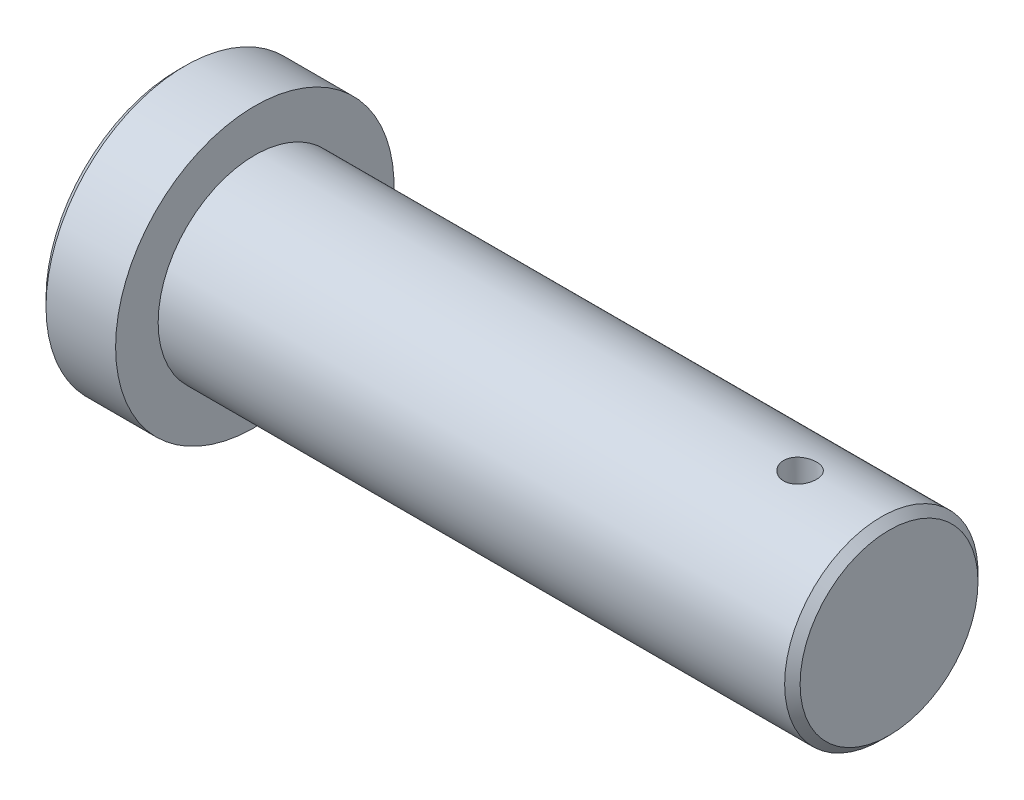
from build123d import *

# Parameters (mm, degrees)
CHAMFER1_SIZE = 1


with BuildPart() as part:
    # Sketch1 → Revolve1 (revolve)
    with BuildSketch(Plane.XY, mode=Mode.PRIVATE) as revolve1_sk:
        Polygon((0, 0), (0, 18), (10, 18), (10, 12.5), (92, 12.5), (92, 0), align=None)
    revolve(revolve1_sk.sketch.rotate(Axis((0, 0, 0), (1, 0, 0)), 90), axis=Axis((0, 0, 0), (1, 0, 0)))

    # Sketch2 → Cut-Revolve1 (revolve, cut)
    with BuildSketch(Plane.XY, mode=Mode.PRIVATE) as cut_revolve1_sk:
        Polygon((83, -12.5), (82.625, 12.5), (80.5, 12.5), (80.5, -12.5), align=None)
    revolve(cut_revolve1_sk.sketch.rotate(Axis((80.5, 12.5, 0), (0, -1, 0)), 227.113167314), axis=Axis((80.5, 12.5, 0), (0, -1, 0)), mode=Mode.SUBTRACT)

    # Chamfer1
    chamfer1_edges = [part.edges().sort_by_distance(p)[0] for p in [
        (92, 0, -12.5),
        (0, 0, -18),
    ]]
    chamfer(chamfer1_edges, length=CHAMFER1_SIZE)


solid = part.part
